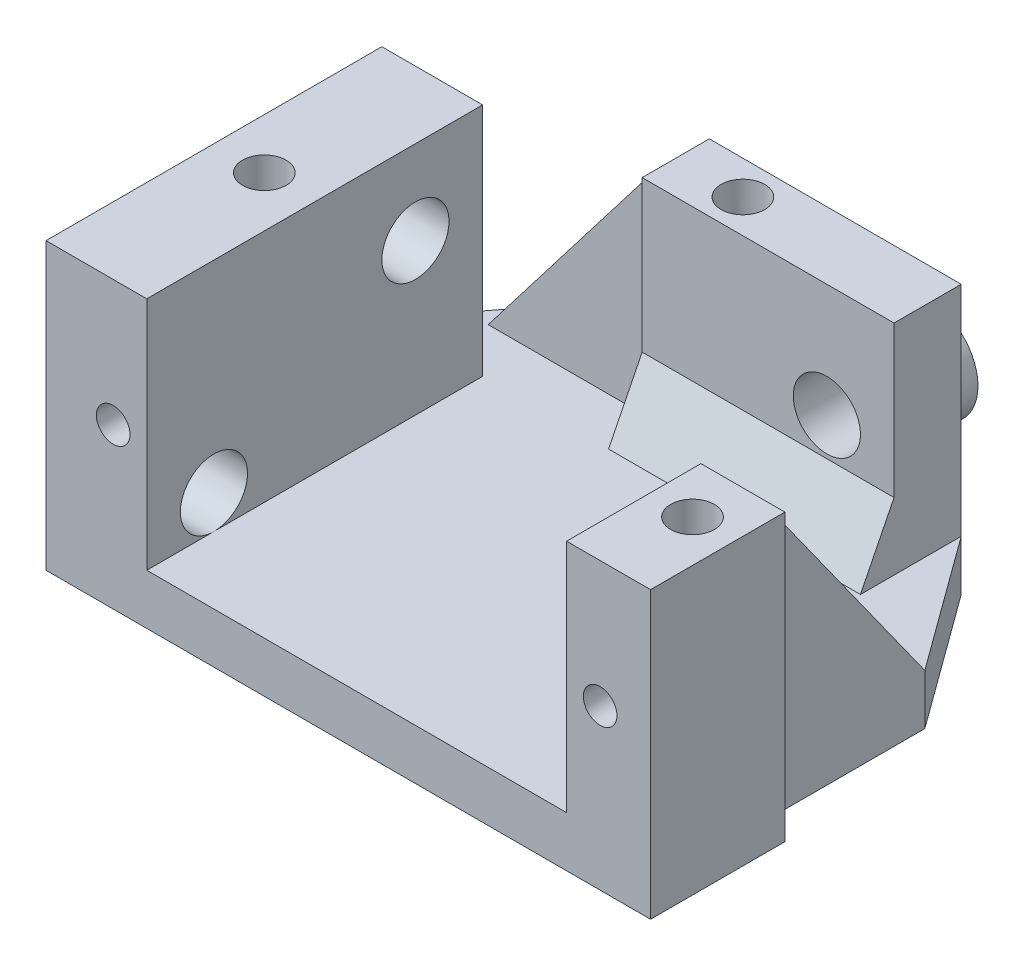
from build123d import *

# Parameters (mm, degrees)
SKETCH1_W           = 50
SKETCH1_H           = 36
BOSS_EXTRUDE1_DEPTH = 3
SKETCH2_W           = 5
SKETCH2_H           = 8
SKETCH2_W_2         = 6
SKETCH2_H_2         = 20
BOSS_EXTRUDE2_DEPTH = 14
SKETCH3_W           = 15
SKETCH3_H           = 4
BOSS_EXTRUDE3_DEPTH = 13
SKETCH4_R           = 3
BOSS_EXTRUDE4_DEPTH = 2
SKETCH5_R           = 2
CUT_EXTRUDE1_DEPTH  = 12
CUT_EXTRUDE2_DEPTH  = 11
SKETCH7_W           = 1.666666666
SKETCH7_H           = 10
BOSS_EXTRUDE5_DEPTH = 14
CUT_EXTRUDE3_REACH  = 45.218
CUT_EXTRUDE4_REACH  = 36.943
SKETCH10_W          = 10
SKETCH10_H          = 1.666666667
BOSS_EXTRUDE7_DEPTH = 13
CUT_EXTRUDE5_DEPTH  = 2
SKETCH12_R          = 2
CUT_EXTRUDE6_DEPTH  = 6
CHAMFER1_SIZE       = 2
CHAMFER1_SIZE2      = 4
CUT_EXTRUDE7_DEPTH  = 5
SKETCH14_R          = 1.3
CUT_EXTRUDE8_DEPTH  = 6
SKETCH15_R          = 1
CUT_EXTRUDE9_DEPTH  = 6


with BuildPart() as part:
    # Sketch1 → Boss-Extrude1 (new body)
    with BuildSketch(Plane(origin=(0, 0, 0), x_dir=(1, 0, 0), z_dir=(0, 1, 0))):
        Rectangle(SKETCH1_W, SKETCH1_H)
    extrude(amount=BOSS_EXTRUDE1_DEPTH)

    # Sketch2 → Boss-Extrude2 (add)
    with BuildSketch(Plane(origin=(0, 3, 0), x_dir=(1, 0, 0), z_dir=(0, 1, 0))):
        with Locations((22.5, -4)):
            Rectangle(SKETCH2_W, SKETCH2_H)
        with Locations((-8, 2)):
            Rectangle(SKETCH2_W_2, SKETCH2_H_2)
    extrude(amount=BOSS_EXTRUDE2_DEPTH)

    # Sketch3 → Boss-Extrude3 (add)
    with BuildSketch(Plane(origin=(0, 3, 0), x_dir=(1, 0, 0), z_dir=(0, 1, 0))):
        with Locations((10, 16)):
            Rectangle(SKETCH3_W, SKETCH3_H)
    extrude(amount=BOSS_EXTRUDE3_DEPTH)

    # Sketch4 → Boss-Extrude4 (add)
    with BuildSketch(Plane(origin=(0, 0, -18), x_dir=(-1, 0, 0), z_dir=(0, 0, -1))):
        with Locations(Location((-13.5, 9.25, 0), (0, 0, 180))):
            Circle(SKETCH4_R)
    extrude(amount=BOSS_EXTRUDE4_DEPTH)

    # Sketch5 → Cut-Extrude1 (cut)
    with BuildSketch(Plane(origin=(0, 0, -20), x_dir=(-1, 0, 0), z_dir=(0, 0, -1))):
        with Locations((-13.5, 9.25)):
            Circle(SKETCH5_R)
    extrude(amount=-CUT_EXTRUDE1_DEPTH, mode=Mode.SUBTRACT)

    # Sketch6 → Cut-Extrude2 (cut)
    with BuildSketch(Plane(origin=(0, 3, 0), x_dir=(1, 0, 0), z_dir=(0, 1, 0))):
        Polygon((-11, 12), (-11, 18), (-25, 18), (-25, -18), (25, -18), (25, -8), (-11, -8), align=None)
    extrude(amount=-CUT_EXTRUDE2_DEPTH, mode=Mode.SUBTRACT)

    # Sketch7 → Boss-Extrude5 (add)
    with BuildSketch(Plane(origin=(0, 17, 0), x_dir=(1, 0, 0), z_dir=(0, 1, 0))):
        with Locations((22.5, 5)):
            Rectangle(SKETCH7_W, SKETCH7_H)
    extrude(amount=-BOSS_EXTRUDE5_DEPTH)

    # Sketch8 → Cut-Extrude3 (cut, up to next)
    with BuildSketch(Plane(origin=(23.333333333, 0, 0), x_dir=(0, 0, -1), z_dir=(1, 0, 0)), mode=Mode.PRIVATE) as cut_extrude3_sk1:
        Polygon((10, 3), (0, 17), (10, 17), align=None)
    cut_extrude3_tool1 = extrude(cut_extrude3_sk1.sketch, amount=-CUT_EXTRUDE3_REACH, mode=Mode.PRIVATE) & part.part
    add(cut_extrude3_tool1.solids().sort_by_distance((23.333333, 12.333333, -6.666667))[0], mode=Mode.SUBTRACT)

    # Sketch9 → Cut-Extrude4 (cut, up to next)
    with BuildSketch(Plane(origin=(0, 3, 0), x_dir=(1, 0, 0), z_dir=(0, 1, 0)), mode=Mode.PRIVATE) as cut_extrude4_sk1:
        Polygon((25, 0), (23.333333333, 0), (23.333333333, 10), (17.5, 18), (25, 18), align=None)
    cut_extrude4_tool1 = extrude(cut_extrude4_sk1.sketch, amount=-CUT_EXTRUDE4_REACH, mode=Mode.PRIVATE) & part.part
    add(cut_extrude4_tool1.solids().sort_by_distance((22.951389, 3, -11.770833))[0], mode=Mode.SUBTRACT)

    # Sketch10 → Boss-Extrude7 (add)
    with BuildSketch(Plane(origin=(0, 3, 0), x_dir=(1, 0, 0), z_dir=(0, 1, 0))):
        with Locations((-2.5, 15.666666666)):
            Rectangle(SKETCH10_W, SKETCH10_H)
    extrude(amount=BOSS_EXTRUDE7_DEPTH)

    # Sketch11 → Cut-Extrude5 (cut)
    with BuildSketch(Plane(origin=(0, 0, -16.5), x_dir=(-1, 0, 0), z_dir=(0, 0, -1))):
        Polygon((7.5, 3), (-2.5, 16), (7.5, 16), align=None)
    extrude(amount=-CUT_EXTRUDE5_DEPTH, mode=Mode.SUBTRACT)

    # Sketch12 → Cut-Extrude6 (cut)
    with BuildSketch(Plane.ZY.offset(11)):
        with Locations((4, 5)):
            Circle(SKETCH12_R)
        with Locations((-8, 12)):
            Circle(SKETCH12_R)
    extrude(amount=-CUT_EXTRUDE6_DEPTH, mode=Mode.SUBTRACT)

    # Chamfer1
    chamfer1_edges = [part.edges().sort_by_distance(p)[0] for p in [
        (10, 3, -14),
    ]]
    chamfer1_side = [part.faces().sort_by_distance(p)[0] for p in [
        (7.078272128, 3, -4.239053672),
    ]]
    chamfer(chamfer1_edges, length=CHAMFER1_SIZE, length2=CHAMFER1_SIZE2, reference=chamfer1_side[0])

    # Sketch13 → Cut-Extrude7 (cut)
    with BuildSketch(Plane(origin=(0, 3, 0), x_dir=(1, 0, 0), z_dir=(0, 1, 0))):
        Polygon((-7.5, 16.5), (-11, 12), (-11, 18), (2.5, 18), (2.5, 16.5), align=None)
    extrude(amount=-CUT_EXTRUDE7_DEPTH, mode=Mode.SUBTRACT)

    # Sketch14 → Cut-Extrude8 (cut)
    with BuildSketch(Plane(origin=(0, 17, 0), x_dir=(1, 0, 0), z_dir=(0, 1, 0))):
        with Locations(Location((6.5, 16, 0), (0, 0, 270))):
            Circle(SKETCH14_R)
        with Locations(Location((-8, 2, 0), (0, 0, 270))):
            Circle(SKETCH14_R)
        with Locations(Location((22.5, -3, 0), (0, 0, 270))):
            Circle(SKETCH14_R)
    extrude(amount=-CUT_EXTRUDE8_DEPTH, mode=Mode.SUBTRACT)

    # Sketch15 → Cut-Extrude9 (cut)
    with BuildSketch(Plane.XY.offset(8)):
        with Locations((-7, 9.5)):
            Circle(SKETCH15_R)
        with Locations((22, 9.5)):
            Circle(SKETCH15_R)
    extrude(amount=-CUT_EXTRUDE9_DEPTH, mode=Mode.SUBTRACT)


solid = part.part
